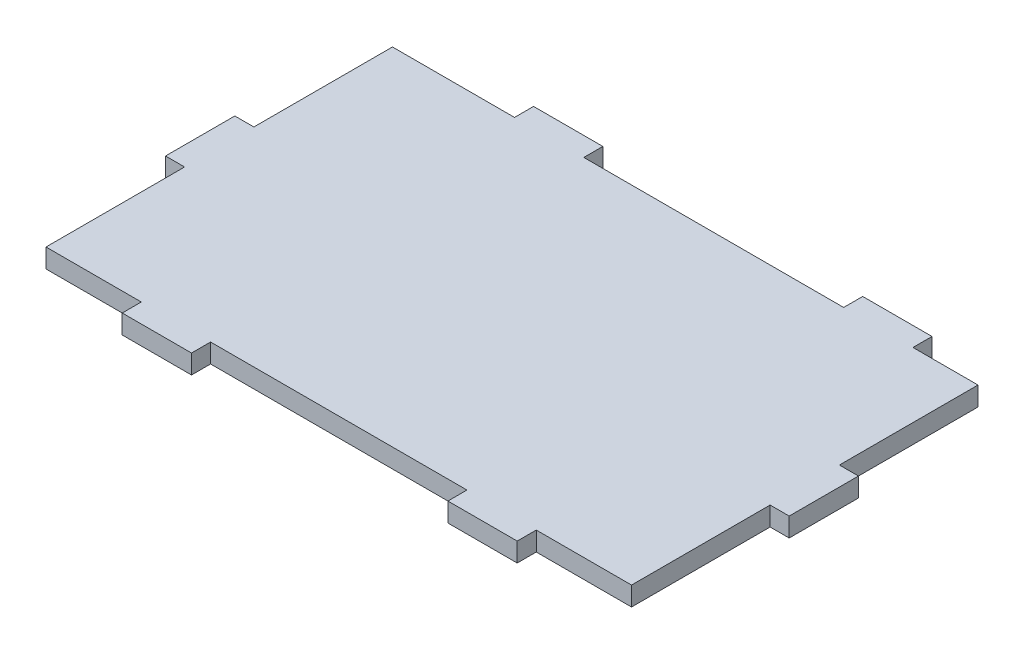
from build123d import *

# Parameters (mm, degrees)
BOSS_EXTRUDE1_DEPTH = 5.5


with BuildPart() as part:
    # Sketch1 → Boss-Extrude1 (new body)
    with BuildSketch(Plane(origin=(0, 0, 0), x_dir=(1, 0, 0), z_dir=(0, 1, 0))):
        Polygon((5.5, 104.5), (40.724518543, 104.5), (40.724518543, 110), (60.724518543, 110), (60.724518543, 104.5), (135.724518543, 104.5), (135.724518543, 110), (155.724518543, 110), (155.724518543, 104.5), (174.5, 104.5), (174.5, 64.5), (180, 64.5), (180, 44.5), (174.5, 44.5), (174.5, 4.5), (147, 4.5), (147, -1), (127, -1), (127, 4.5), (53, 4.5), (53, -1), (33, -1), (33, 4.5), (5.5, 4.5), (5.5, 44.5), (0, 44.5), (0, 64.5), (5.5, 64.5), align=None)
    extrude(amount=BOSS_EXTRUDE1_DEPTH)


solid = part.part
